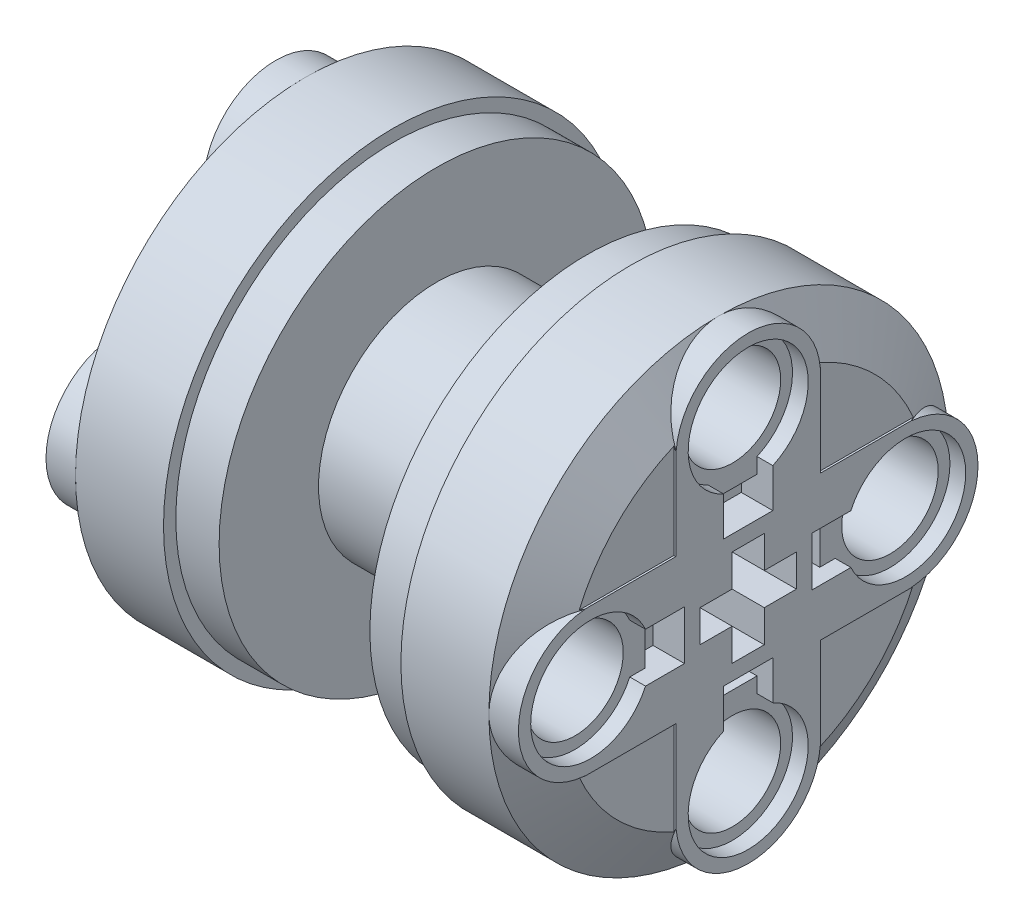
from build123d import *

# Parameters (mm, degrees)
SKETCH2_R          = 11.675
EXTRUDE1_DEPTH     = 5.97
CHAMFER1_SIZE      = 1.5
CHAMFER1_SIZE2     = 2.598076211
SKETCH6_R          = 3.675
EXTRUDE2_DEPTH     = 5.97
CIRPATTERN2_COUNT  = 4
SKETCH8_R          = 11.05
EXTRUDE3_DEPTH     = 2.2
SKETCH4_R          = 2.45
CUT_EXTRUDE1_DEPTH = 8
SKETCH5_R          = 3.05
CUT_EXTRUDE2_DEPTH = 0.8
SKETCH10_W         = 2.656329657
SKETCH10_H         = 2.5
CUT_EXTRUDE3_DEPTH = 0.8
SKETCH11_W         = 1.2
SKETCH11_H         = 2.5
CUT_EXTRUDE4_DEPTH = 0.8
CIRPATTERN3_COUNT  = 4
CUT_EXTRUDE5_DEPTH = 0.1
CIRPATTERN4_COUNT  = 4
SKETCH13_R         = 6
EXTRUDE5_DEPTH     = 7.66
CUT_EXTRUDE6_DEPTH = 30.130933035


with BuildPart() as part:
    # Sketch2 → Extrude1 (new body)
    with BuildSketch(Plane(origin=(6.03, 0, 0), x_dir=(0, 0, -1), z_dir=(1, 0, 0))):
        with Locations(Location((0, 0, 0), (0, 0, 180))):
            Circle(SKETCH2_R)
    extrude(amount=EXTRUDE1_DEPTH)

    # Chamfer1
    chamfer1_edges = [part.edges().sort_by_distance(p)[0] for p in [
        (12, 0, -11.675),
    ]]
    chamfer1_side = [part.faces().sort_by_distance(p)[0] for p in [
        (9.015, 0, -11.675),
    ]]
    chamfer(chamfer1_edges, length=CHAMFER1_SIZE, length2=CHAMFER1_SIZE2, reference=chamfer1_side[0])

    # Sketch6 → Extrude2 (add)
    with BuildSketch(Plane(origin=(6.03, 0, 0), x_dir=(0, 0, -1), z_dir=(1, 0, 0))):
        with Locations((-8, 0)):
            Circle(SKETCH6_R)
    extrude2 = extrude(amount=EXTRUDE2_DEPTH)

    # CirPattern2: Extrude2 ×4 about axis
    cirpattern2_axis = Axis((0, 0, 0), (1, 0, 0))
    for i in range(1, CIRPATTERN2_COUNT):
        add(extrude2.rotate(cirpattern2_axis, i * 360 / CIRPATTERN2_COUNT))

    # Sketch8 → Extrude3 (add)
    with BuildSketch(Plane.ZY.offset(-6.03)):
        with Locations(Location((0, 0, 0), (0, 0, 180))):
            Circle(SKETCH8_R)
    extrude(amount=EXTRUDE3_DEPTH)

    # Sketch4 → Cut-Extrude1 (cut)
    with BuildSketch(Plane(origin=(12, 0, 0), x_dir=(0, 0, -1), z_dir=(1, 0, 0))):
        with Locations((-8, 0)):
            Circle(SKETCH4_R)
        with Locations(Location((8, 0, 0), (0, 0, 180))):
            Circle(SKETCH4_R)
        with Locations((0, 8)):
            Circle(SKETCH4_R)
        with Locations(Location((0, -8, 0), (0, 0, 180))):
            Circle(SKETCH4_R)
    extrude(amount=-CUT_EXTRUDE1_DEPTH, mode=Mode.SUBTRACT)

    # Sketch5 → Cut-Extrude2 (cut)
    with BuildSketch(Plane(origin=(12, 0, 0), x_dir=(0, 0, -1), z_dir=(1, 0, 0))):
        with Locations((-8, 0)):
            Circle(SKETCH5_R)
        with Locations((0, 8)):
            Circle(SKETCH5_R)
        with Locations((0, -8)):
            Circle(SKETCH5_R)
        with Locations((8, 0)):
            Circle(SKETCH5_R)
    extrude(amount=-CUT_EXTRUDE2_DEPTH, mode=Mode.SUBTRACT)

    # Sketch10 → Cut-Extrude3 (cut)
    with BuildSketch(Plane(origin=(12, 0, 0), x_dir=(0, 0, -1), z_dir=(1, 0, 0))):
        with Locations((-4.564704421, 0)):
            Rectangle(SKETCH10_W, SKETCH10_H)
    cut_extrude3 = extrude(amount=-CUT_EXTRUDE3_DEPTH, mode=Mode.SUBTRACT)

    # Sketch11 → Cut-Extrude4 (cut)
    with BuildSketch(Plane(origin=(11.2, 0, 0), x_dir=(0, 0, -1), z_dir=(1, 0, 0))):
        with Locations((-3.836539592, 0)):
            Rectangle(SKETCH11_W, SKETCH11_H)
    cut_extrude4 = extrude(amount=-CUT_EXTRUDE4_DEPTH, mode=Mode.SUBTRACT)

    # CirPattern3: Cut-Extrude3, Cut-Extrude4 ×4 about axis
    cirpattern3_axis = Axis((0, 0, 0), (1, 0, 0))
    add([cut_extrude3.rotate(cirpattern3_axis, i * 360 / CIRPATTERN3_COUNT) for i in range(1, CIRPATTERN3_COUNT)], mode=Mode.SUBTRACT)
    add([cut_extrude4.rotate(cirpattern3_axis, i * 360 / CIRPATTERN3_COUNT) for i in range(1, CIRPATTERN3_COUNT)], mode=Mode.SUBTRACT)

    # Sketch12 → Cut-Extrude5 (cut)
    with BuildSketch(Plane(origin=(12, 0, 0), x_dir=(0, 0, -1), z_dir=(1, 0, 0))):
        with BuildLine():
            Line((-3.675, 12.392113067), (-3.675, 3.675))
            Line((-3.675, 3.675), (-12.778242755, 3.675))
            ThreePointArc((-12.778242755, 3.675), (-10.087559557, 9.976926072), (-3.675, 12.392113067))
        make_face()
    cut_extrude5 = extrude(amount=-CUT_EXTRUDE5_DEPTH, mode=Mode.SUBTRACT)

    # CirPattern4: Cut-Extrude5 ×4 about axis
    cirpattern4_axis = Axis((0, 0, 0), (1, 0, 0))
    for i in range(1, CIRPATTERN4_COUNT):
        add(cut_extrude5.rotate(cirpattern4_axis, i * 360 / CIRPATTERN4_COUNT), mode=Mode.SUBTRACT)


with BuildPart() as body_2:
    # Mirror3: mirrored copy
    add(part.part.mirror(Plane(origin=(0, 0, 0), x_dir=(0, 0, 1), z_dir=(1, 0, 0))))


with BuildPart() as body_3:
    # Sketch13 → Extrude5 (new body)
    with BuildSketch(Plane.ZY.offset(-3.83)):
        with Locations(Location((0, 0, 0), (0, 0, 180))):
            Circle(SKETCH13_R)
    extrude(amount=EXTRUDE5_DEPTH)


with BuildPart() as body_2_1:
    add(body_2.part)

    # Combine1: union body 3, part
    add(body_3.part)
    add(part.part)

    # Sketch3 → Cut-Extrude6 (cut, through all)
    with BuildSketch(Plane(origin=(12, 0, 0), x_dir=(0, 0, -1), z_dir=(1, 0, 0))):
        Polygon((-0.816666667, 2.45), (0.816666667, 2.45), (0.816666667, 0.816666667), (2.45, 0.816666667), (2.45, -0.816666667), (0.816666667, -0.816666667), (0.816666667, -2.45), (-0.816666667, -2.45), (-0.816666667, -0.816666667), (-2.45, -0.816666667), (-2.45, 0.816666667), (-0.816666667, 0.816666667), align=None)
    extrude(amount=-CUT_EXTRUDE6_DEPTH, mode=Mode.SUBTRACT)


solid = body_2_1.part
